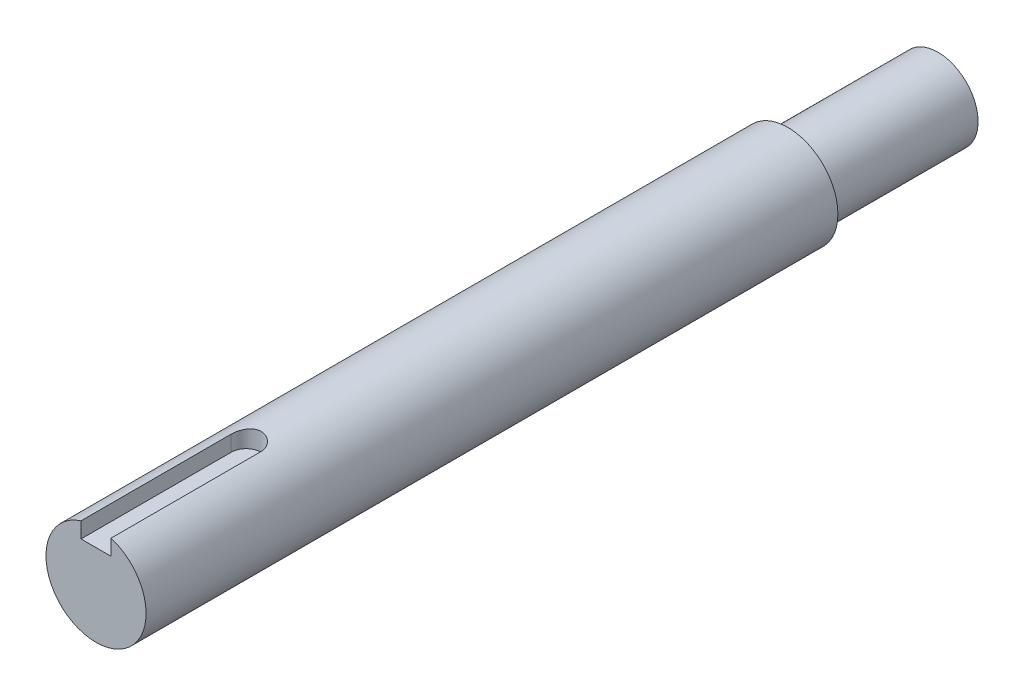
from build123d import *

# Parameters (mm, degrees)
SKETCH_1_R          = 5
EXTRUDE_1_DEPTH     = 69.1
SKETCH_3_R          = 4
EXTRUDE_3_DEPTH     = 15
CUT_EXTRUDE_1_DEPTH = 1.8


with BuildPart() as part:
    # ｽｹｯﾁ1 → ﾎﾞｽ - 押し出し1 (new body)
    with BuildSketch(Plane.XY):
        Circle(SKETCH_1_R)
    extrude(amount=EXTRUDE_1_DEPTH)

    # ｽｹｯﾁ3 → ﾎﾞｽ - 押し出し3 (add)
    with BuildSketch(Plane(origin=(0, 0, 0), x_dir=(-1, 0, 0), z_dir=(0, 0, -1))):
        Circle(SKETCH_3_R)
    extrude(amount=EXTRUDE_3_DEPTH)

    # ｽｹｯﾁ4 → ｶｯﾄ - 押し出し1 (cut)
    with BuildSketch(Plane(origin=(0, 5, 0), x_dir=(1, 0, 0), z_dir=(0, 1, 0))):
        with BuildLine():
            ThreePointArc((1.5, -54.1), (0, -52.6), (-1.5, -54.1))
            Line((-1.5, -54.1), (1.5, -54.1))
        make_face()
        with BuildLine():
            Line((1.5, -54.1), (-1.5, -54.1))
            ThreePointArc((-1.5, -54.1), (0, -55.6), (1.5, -54.1))
        make_face()
        with BuildLine():
            ThreePointArc((1.5, -54.1), (0, -55.6), (-1.5, -54.1))
            Line((-1.5, -54.1), (-1.5, -69.1))
            Line((-1.5, -69.1), (1.5, -69.1))
            Line((1.5, -69.1), (1.5, -54.1))
        make_face()
    extrude(amount=-CUT_EXTRUDE_1_DEPTH, mode=Mode.SUBTRACT)


solid = part.part
